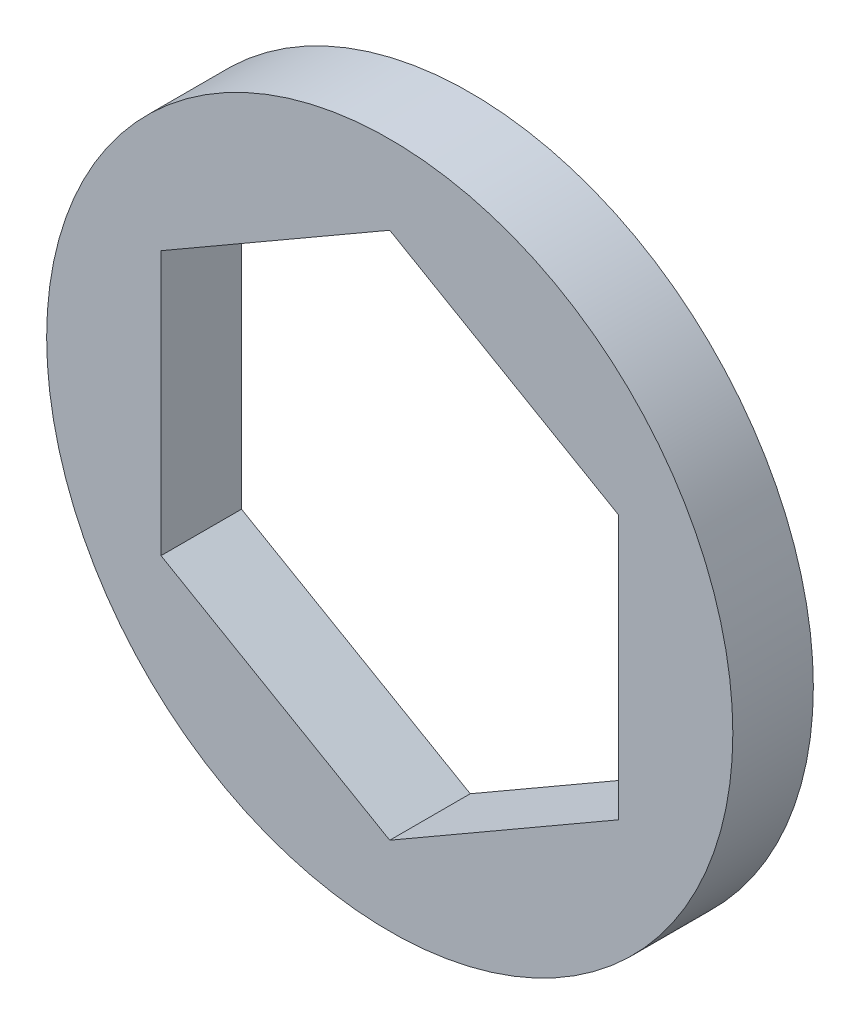
from build123d import *

# Parameters (mm, degrees)
SKETCH1_R           = 9.525
BOSS_EXTRUDE1_DEPTH = 2.2352


with BuildPart() as part:
    # Sketch1 → Boss-Extrude1 (new body)
    with BuildSketch(Plane.XY):
        Circle(SKETCH1_R)
        Polygon((0, 7.332348419), (-6.35, 3.666174209), (-6.35, -3.666174209), (0, -7.332348419), (6.35, -3.666174209), (6.35, 3.666174209), align=None, mode=Mode.SUBTRACT)
    extrude(amount=BOSS_EXTRUDE1_DEPTH)


solid = part.part
